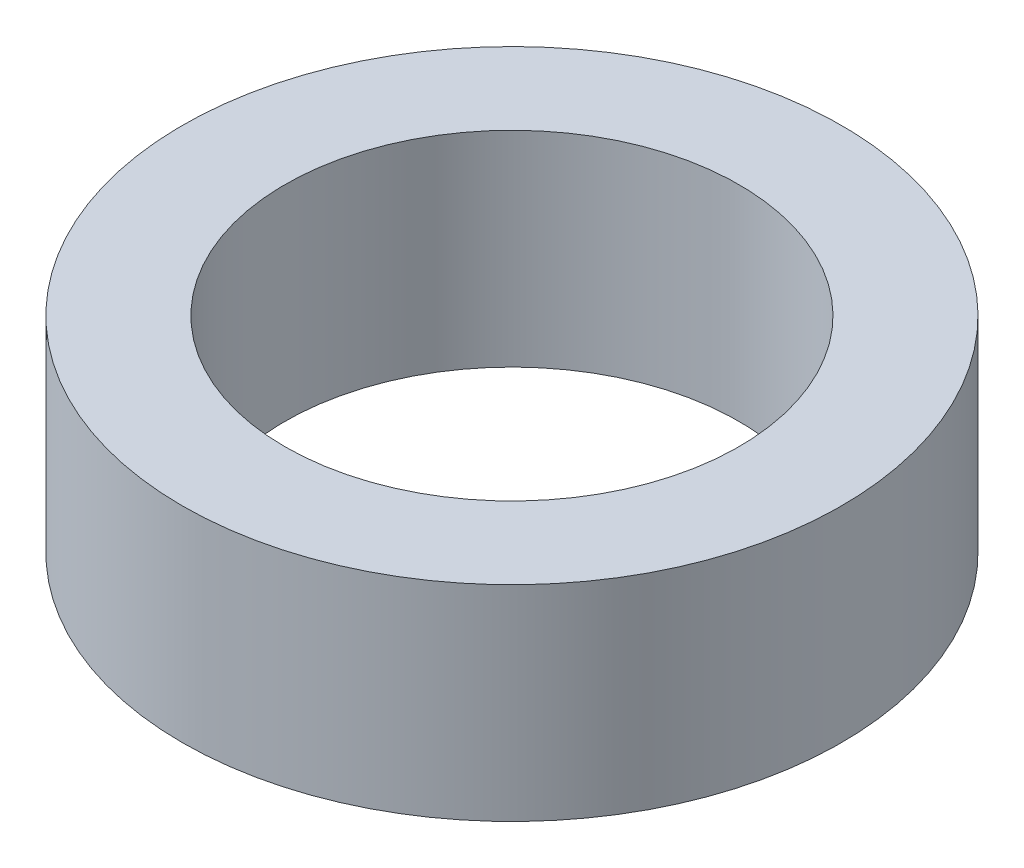
from build123d import *

# Parameters (mm, degrees)
AXLE_TENSION_BEARING_R   = 10.205128061
AXLE_TENSION_BEARING_R_2 = 7.030128061
BOSS_EXTRUDE1_DEPTH      = 6.35


with BuildPart() as part:
    # Axle Tension Bearing → Boss-Extrude1 (new body)
    with BuildSketch(Plane(origin=(0, 0, 0), x_dir=(1, 0, 0), z_dir=(0, 1, 0))):
        with Locations(Location((0, 0, 0), (0, 0, 270))):
            Circle(AXLE_TENSION_BEARING_R)
        with Locations(Location((0, 0, 0), (0, 0, 270))):
            Circle(AXLE_TENSION_BEARING_R_2, mode=Mode.SUBTRACT)
    extrude(amount=BOSS_EXTRUDE1_DEPTH)


solid = part.part
